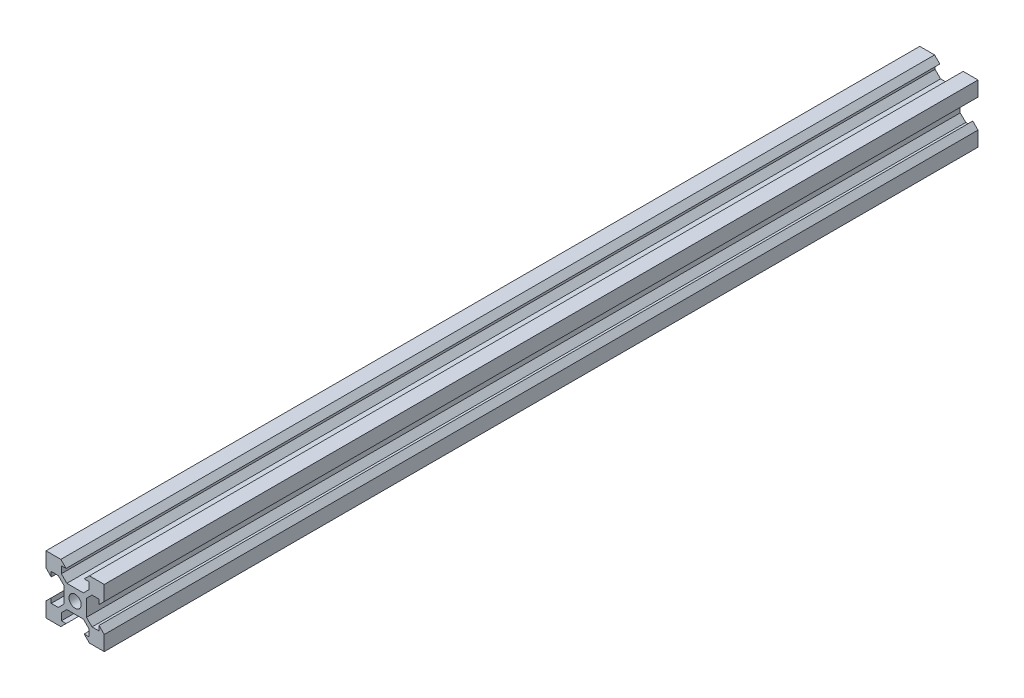
from build123d import *

# Parameters (mm, degrees)
SKETCH1_R           = 2.1
BOSS_EXTRUDE1_DEPTH = 150


with BuildPart() as part:
    # Sketch1 → Boss-Extrude1 (new, symmetric)
    with BuildSketch(Plane.XY):
        Polygon((-3.900660172, -2.84), (-3.900660172, 2.84), (-5.800660172, 4.74), (-8.2, 4.74), (-8.2, 3.1), (-10, 4.9), (-10, 10), (-4.9, 10), (-3.1, 8.2), (-4.74, 8.2), (-4.74, 5.800660172), (-2.84, 3.900660172), (0, 3.900660172), (2.84, 3.900660172), (4.74, 5.800660172), (4.74, 8.2), (3.1, 8.2), (4.9, 10), (10, 10), (10, 4.9), (8.2, 3.1), (8.2, 4.74), (5.800660172, 4.74), (3.900660172, 2.84), (3.900660172, -2.84), (5.800660172, -4.74), (8.2, -4.74), (8.2, -3.1), (10, -4.9), (10, -10), (4.9, -10), (3.1, -8.2), (4.74, -8.2), (4.74, -5.800660172), (2.84, -3.900660172), (0, -3.900660172), (-2.84, -3.900660172), (-4.74, -5.800660172), (-4.74, -8.2), (-3.1, -8.2), (-4.9, -10), (-10, -10), (-10, -4.9), (-8.2, -3.1), (-8.2, -4.74), (-5.800660172, -4.74), align=None)
        Circle(SKETCH1_R, mode=Mode.SUBTRACT)
    extrude(amount=BOSS_EXTRUDE1_DEPTH, both=True)


solid = part.part
